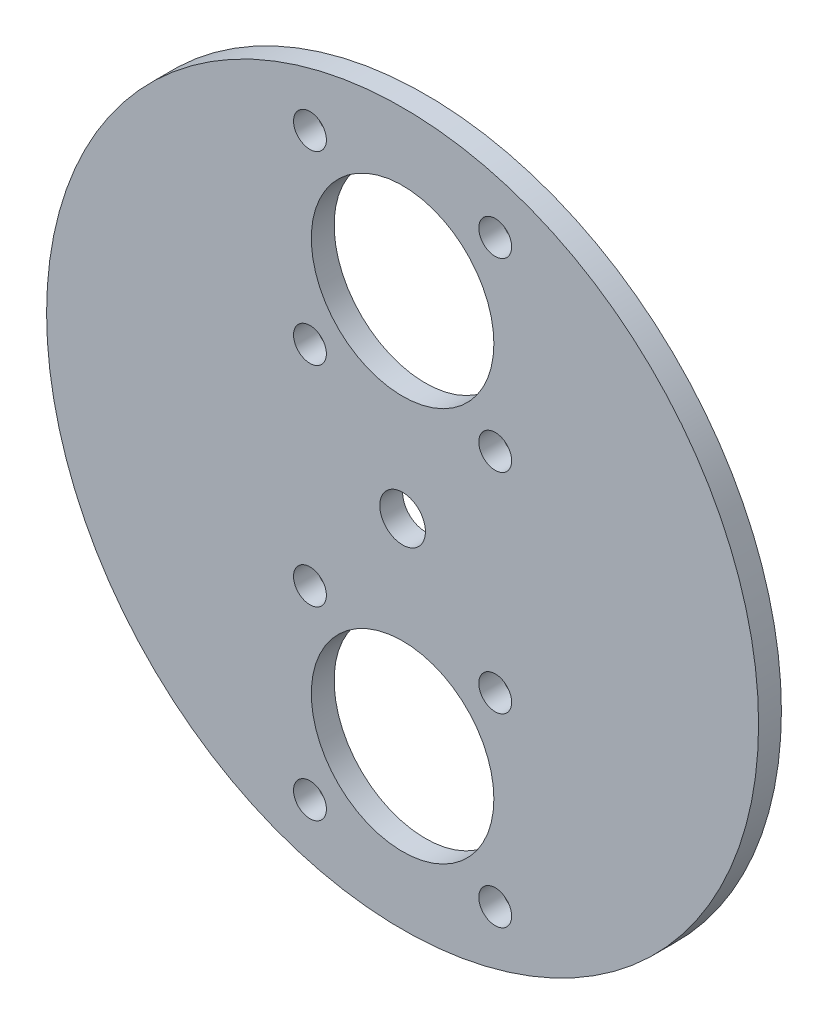
from build123d import *

# Parameters (mm, degrees)
SKETCH1_R           = 49.53
BOSS_EXTRUDE1_DEPTH = 3.175
SKETCH2_R           = 12.7
CUT_EXTRUDE1_DEPTH  = 3.175
SKETCH3_R           = 3.175
CUT_EXTRUDE2_DEPTH  = 3.175
SKETCH5_R           = 2.286
CUT_EXTRUDE3_DEPTH  = 3.175
CIRPATTERN1_COUNT   = 4
SKETCH6_R           = 2.286
CUT_EXTRUDE4_DEPTH  = 3.175
CIRPATTERN2_COUNT   = 4


with BuildPart() as part:
    # Sketch1 → Boss-Extrude1 (new body)
    with BuildSketch(Plane.XY):
        Circle(SKETCH1_R)
    extrude(amount=BOSS_EXTRUDE1_DEPTH)

    # Sketch2 → Cut-Extrude1 (cut)
    with BuildSketch(Plane.XY.offset(3.175)):
        with Locations((0, 27.432)):
            Circle(SKETCH2_R)
        with Locations((0, -27.432)):
            Circle(SKETCH2_R)
    extrude(amount=-CUT_EXTRUDE1_DEPTH, mode=Mode.SUBTRACT)

    # Sketch3 → Cut-Extrude2 (cut)
    with BuildSketch(Plane.XY.offset(3.175)):
        Circle(SKETCH3_R)
    extrude(amount=-CUT_EXTRUDE2_DEPTH, mode=Mode.SUBTRACT)

    # Sketch5 → Cut-Extrude3 (cut)
    with BuildSketch(Plane(origin=(0, 0, 0), x_dir=(-1, 0, 0), z_dir=(0, 0, -1))):
        with Locations((-12.886667534, -14.545332466)):
            Circle(SKETCH5_R)
    cut_extrude3 = extrude(amount=-CUT_EXTRUDE3_DEPTH, mode=Mode.SUBTRACT)

    # CirPattern1: Cut-Extrude3 ×4 about axis
    cirpattern1_axis = Axis((0, -27.432, 0), (0, 0, 1))
    for i in range(1, CIRPATTERN1_COUNT):
        add(cut_extrude3.rotate(cirpattern1_axis, i * 360 / CIRPATTERN1_COUNT), mode=Mode.SUBTRACT)

    # Sketch6 → Cut-Extrude4 (cut)
    with BuildSketch(Plane(origin=(0, 0, 0), x_dir=(-1, 0, 0), z_dir=(0, 0, -1))):
        with Locations((12.886667534, 14.545332466)):
            Circle(SKETCH6_R)
    cut_extrude4 = extrude(amount=-CUT_EXTRUDE4_DEPTH, mode=Mode.SUBTRACT)

    # CirPattern2: Cut-Extrude4 ×4 about axis
    cirpattern2_axis = Axis((0, 27.432, 0), (0, 0, 1))
    for i in range(1, CIRPATTERN2_COUNT):
        add(cut_extrude4.rotate(cirpattern2_axis, i * 360 / CIRPATTERN2_COUNT), mode=Mode.SUBTRACT)


solid = part.part
